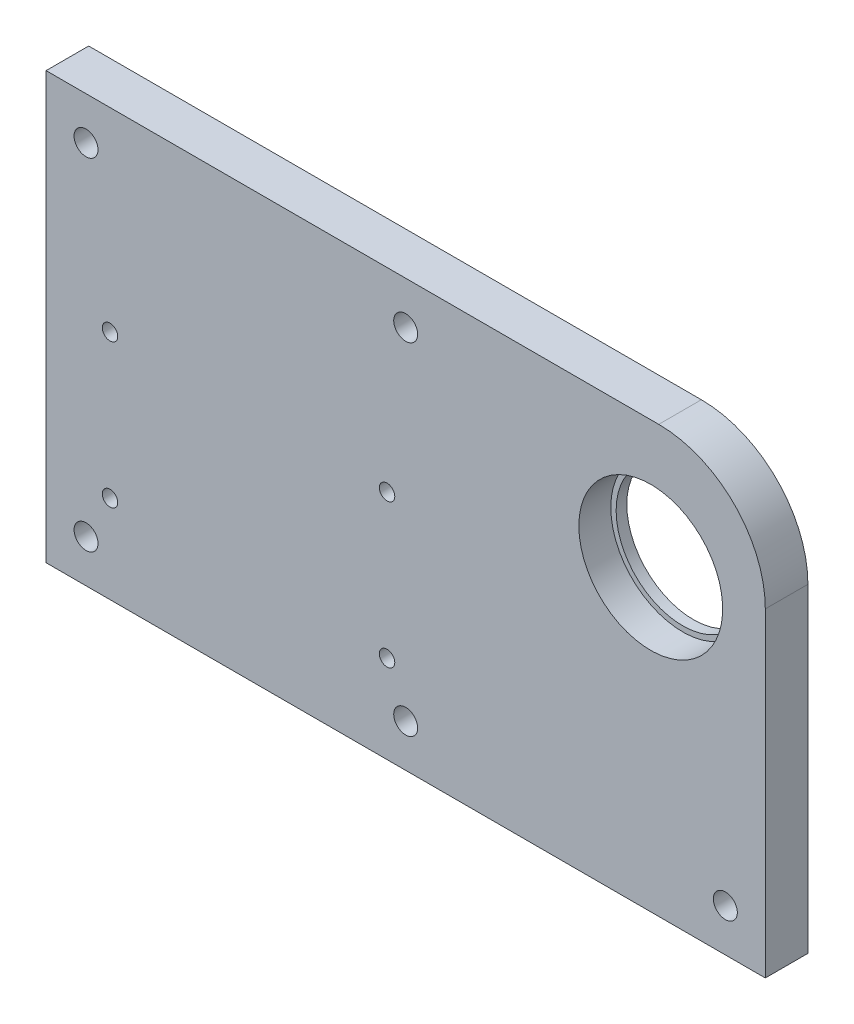
from build123d import *

# Parameters (mm, degrees)
SKETCH1_W                       = 135
SKETCH1_H                       = 80
BOSS_EXTRUDE1_DEPTH             = 8
CBORE_FOR_M2_5_SHCS1_AT_2_COUNT = 2
CBORE_FOR_M2_5_SHCS1_AT_2_PITCH = 27
CBORE_FOR_M2_5_SHCS1_AT_3_COUNT = 2
CBORE_FOR_M2_5_SHCS1_AT_3_PITCH = 58.591808301
CBORE_FOR_M2_5_SHCS1_AT_4_COUNT = 2
CBORE_FOR_M2_5_SHCS1_AT_4_PITCH = 52
CBORE_FOR_M4_SHCS3_AT_2_COUNT   = 2
CBORE_FOR_M4_SHCS3_AT_2_PITCH   = 60
CBORE_FOR_M4_SHCS3_AT_3_COUNT   = 2
CBORE_FOR_M4_SHCS3_AT_3_PITCH   = 120
CBORE_FOR_M4_SHCS3_AT_4_COUNT   = 2
CBORE_FOR_M4_SHCS3_AT_4_PITCH   = 64
CBORE_FOR_M4_SHCS3_AT_5_COUNT   = 2
CBORE_FOR_M4_SHCS3_AT_5_PITCH   = 87.726848798
FILLET1_R                       = 20


with BuildPart() as part:
    # Sketch1 → Boss-Extrude1 (new body)
    with BuildSketch(Plane.XY):
        with Locations((14, 10)):
            Rectangle(SKETCH1_W, SKETCH1_H)
    extrude(amount=BOSS_EXTRUDE1_DEPTH)

    # Sketch4 → CBORE for M2.5 SHCS1 (revolve, cut)
    with BuildSketch(Plane(origin=(10.5, 13.5, 0), x_dir=(0, 1, 0), z_dir=(1, 0, 0))):
        Polygon((0, 0), (0, 8), (1.45, 8), (1.45, 2.5), (2.75, 2.5), (2.75, 0.025), (2.775, 0), align=None)
    cbore_for_m2_5_shcs1 = revolve(axis=Axis((10.5, 13.5, -6.35), (0, 0, 1)), mode=Mode.SUBTRACT)

    # CBORE for M2.5 SHCS1 at 2: CBORE for M2.5 SHCS1 ×2
    with Locations(*[(0, -i * CBORE_FOR_M2_5_SHCS1_AT_2_PITCH, 0) for i in range(1, CBORE_FOR_M2_5_SHCS1_AT_2_COUNT)]):
        add(cbore_for_m2_5_shcs1, mode=Mode.SUBTRACT)

    # CBORE for M2.5 SHCS1 at 3: CBORE for M2.5 SHCS1 ×2
    with Locations(*[Vector(-0.8874960768017397, -0.4608152706470572, 0) * (i * CBORE_FOR_M2_5_SHCS1_AT_3_PITCH) for i in range(1, CBORE_FOR_M2_5_SHCS1_AT_3_COUNT)]):
        add(cbore_for_m2_5_shcs1, mode=Mode.SUBTRACT)

    # CBORE for M2.5 SHCS1 at 4: CBORE for M2.5 SHCS1 ×2
    with Locations(*[(-i * CBORE_FOR_M2_5_SHCS1_AT_4_PITCH, 0, 0) for i in range(1, CBORE_FOR_M2_5_SHCS1_AT_4_COUNT)]):
        add(cbore_for_m2_5_shcs1, mode=Mode.SUBTRACT)

    # Sketch5 → Cut-Revolve1 (revolve, cut)
    with BuildSketch(Plane(origin=(60, 0, 0), x_dir=(0, 0, -1), z_dir=(1, 0, 0))):
        Polygon((-8, 39.5), (-2, 39.5), (-2, 38.5), (0, 38.5), (0, 26), (-8, 26), align=None)
    revolve(axis=Axis((60, 26, 0), (0, 0, 1)), mode=Mode.SUBTRACT)

    # Sketch17 → CBORE for M4 SHCS3 (revolve, cut)
    with BuildSketch(Plane(origin=(-46, -22, 0), x_dir=(0, 1, 0), z_dir=(1, 0, 0))):
        Polygon((0, 0), (0, 8), (2.25, 8), (2.25, 4), (4, 4), (4, 0.025), (4.025, 0), align=None)
    cbore_for_m4_shcs3 = revolve(axis=Axis((-46, -22, -6.35), (0, 0, 1)), mode=Mode.SUBTRACT)

    # CBORE for M4 SHCS3 at 2: CBORE for M4 SHCS3 ×2
    with Locations(*[(i * CBORE_FOR_M4_SHCS3_AT_2_PITCH, 0, 0) for i in range(1, CBORE_FOR_M4_SHCS3_AT_2_COUNT)]):
        add(cbore_for_m4_shcs3, mode=Mode.SUBTRACT)

    # CBORE for M4 SHCS3 at 3: CBORE for M4 SHCS3 ×2
    with Locations(*[(i * CBORE_FOR_M4_SHCS3_AT_3_PITCH, 0, 0) for i in range(1, CBORE_FOR_M4_SHCS3_AT_3_COUNT)]):
        add(cbore_for_m4_shcs3, mode=Mode.SUBTRACT)

    # CBORE for M4 SHCS3 at 4: CBORE for M4 SHCS3 ×2
    with Locations(*[(0, i * CBORE_FOR_M4_SHCS3_AT_4_PITCH, 0) for i in range(1, CBORE_FOR_M4_SHCS3_AT_4_COUNT)]):
        add(cbore_for_m4_shcs3, mode=Mode.SUBTRACT)

    # CBORE for M4 SHCS3 at 5: CBORE for M4 SHCS3 ×2
    with Locations(*[Vector(0.6839411288813297, 0.7295372041400852, 0) * (i * CBORE_FOR_M4_SHCS3_AT_5_PITCH) for i in range(1, CBORE_FOR_M4_SHCS3_AT_5_COUNT)]):
        add(cbore_for_m4_shcs3, mode=Mode.SUBTRACT)

    # Fillet1
    fillet1_edges = [part.edges().sort_by_distance(p)[0] for p in [
        (81.5, 50, 4),
    ]]
    fillet(fillet1_edges, radius=FILLET1_R)


solid = part.part
